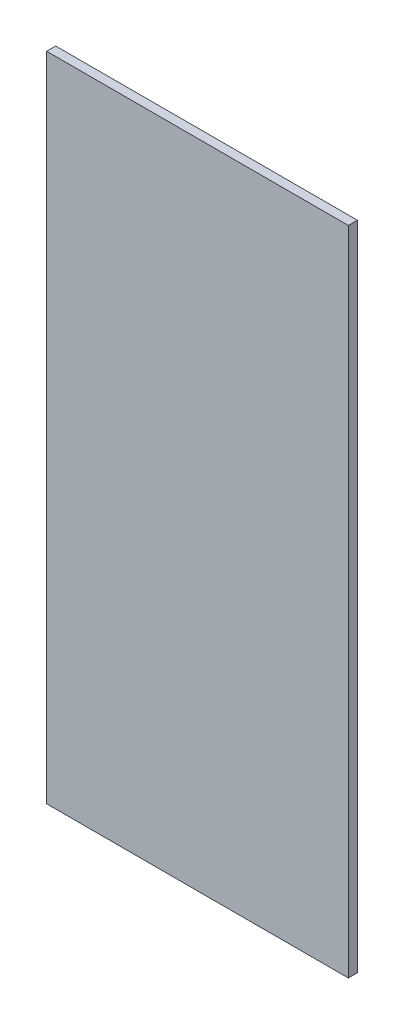
from build123d import *

# Parameters (mm, degrees)
SKETCH1_W           = 635
SKETCH1_H           = 1371.6
BOSS_EXTRUDE1_DEPTH = 19.05


with BuildPart() as part:
    # Sketch1 → Boss-Extrude1 (new body)
    with BuildSketch(Plane.XY):
        with Locations((317.5, -685.8)):
            Rectangle(SKETCH1_W, SKETCH1_H)
    extrude(amount=BOSS_EXTRUDE1_DEPTH)


solid = part.part
